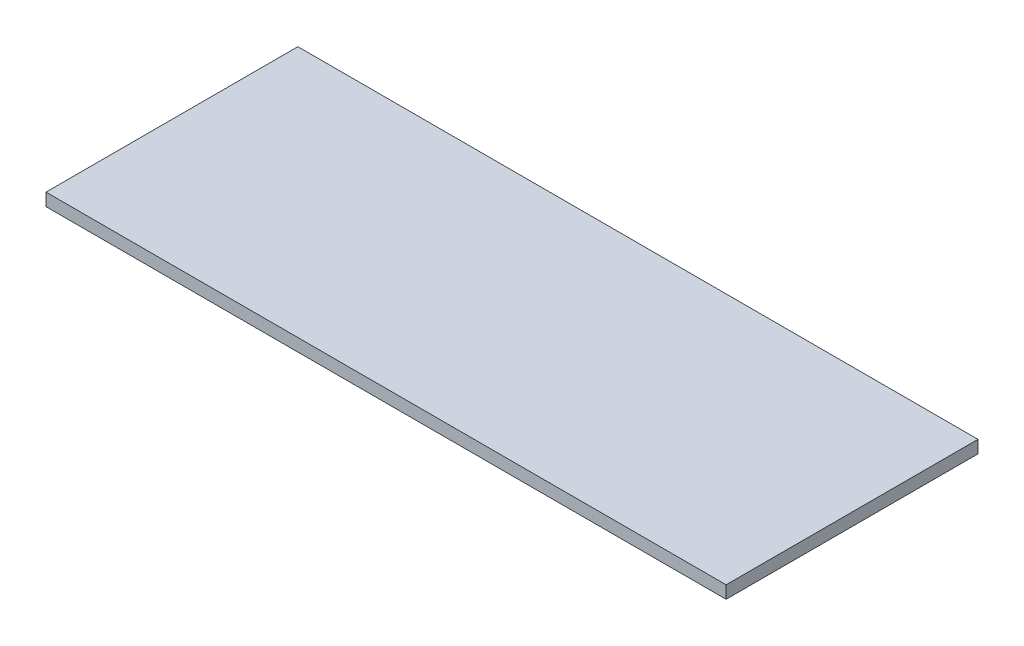
from build123d import *

# Parameters (mm, degrees)
SKETCH1_W           = 162
SKETCH1_H           = 60
BOSS_EXTRUDE1_DEPTH = 3


with BuildPart() as part:
    # Sketch1 → Boss-Extrude1 (new body)
    with BuildSketch(Plane(origin=(0, 0, 0), x_dir=(1, 0, 0), z_dir=(0, 1, 0))):
        Rectangle(SKETCH1_W, SKETCH1_H)
    extrude(amount=BOSS_EXTRUDE1_DEPTH)


solid = part.part
